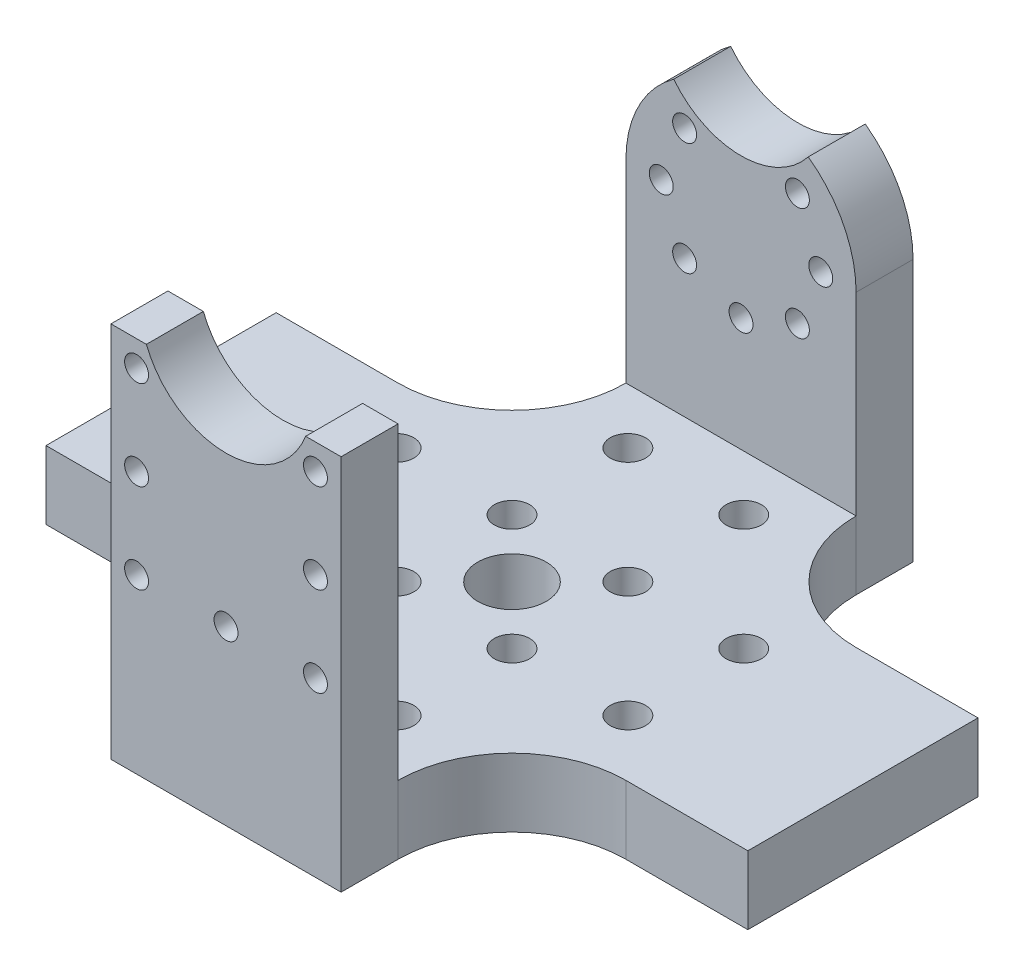
from build123d import *

# Parameters (mm, degrees)
BOSS_EXTRUDE1_DEPTH = 50.2
CUT_EXTRUDE2_DEPTH  = 44.2
SKETCH3_W           = 20.2
SKETCH3_H           = 10.1
BOSS_EXTRUDE2_DEPTH = 5
SKETCH4_R           = 1.05
CUT_EXTRUDE3_DEPTH  = 11
SKETCH5_R           = 4
SKETCH5_R_2         = 7.5
CUT_EXTRUDE4_DEPTH  = 11
SKETCH6_R           = 4
BOSS_EXTRUDE3_DEPTH = 5
SKETCH7_R           = 4
SKETCH7_R_2         = 1.05
CUT_EXTRUDE5_DEPTH  = 16
SKETCH8_R           = 7.5
CUT_EXTRUDE6_DEPTH  = 11
SKETCH9_R           = 4
BOSS_EXTRUDE4_DEPTH = 5
SKETCH11_W          = 20.2
SKETCH11_H          = 50.2
BOSS_EXTRUDE5_DEPTH = 3
SKETCH12_R          = 3
SKETCH12_R_2        = 1.55
CUT_EXTRUDE8_DEPTH  = 23
SKETCH13_W          = 20.7
SKETCH13_H          = 20.2
BOSS_EXTRUDE6_DEPTH = 6
SKETCH14_R          = 1.55
CUT_EXTRUDE9_DEPTH  = 6
SKETCH15_R          = 1.55
CUT_EXTRUDE10_DEPTH = 6
FILLET1_R           = 10
FILLET2_R           = 10
FILLET3_R           = 10


with BuildPart() as part:
    # Sketch1 → Boss-Extrude1 (new body)
    with BuildSketch(Plane.XY):
        with BuildLine():
            Line((-10.1, 0), (-10.1, -20))
            Line((-10.1, -20), (10.1, -20))
            Line((10.1, -20), (10.1, 0))
            ThreePointArc((10.1, 0), (0, 10.1), (-10.1, 0))
        make_face()
    extrude(amount=BOSS_EXTRUDE1_DEPTH)

    # Sketch2 → Cut-Extrude2 (cut)
    with BuildSketch(Plane.ZY.offset(10.1)):
        Polygon((5, -10), (5, -17), (45.2, -17), (45.2, -10), (45.2, 11.866817026), (5, 11.866817026), align=None)
    extrude(amount=-CUT_EXTRUDE2_DEPTH, mode=Mode.SUBTRACT)

    # Sketch3 → Boss-Extrude2 (add)
    with BuildSketch(Plane.XY.offset(50.2)):
        with Locations((0, 5.05)):
            Rectangle(SKETCH3_W, SKETCH3_H)
    extrude(amount=-BOSS_EXTRUDE2_DEPTH)

    # Sketch4 → Cut-Extrude3 (cut, symmetric)
    with BuildSketch(Plane.XY.offset(50.2)):
        with Locations((-7.85, 7.85)):
            Circle(SKETCH4_R)
        with Locations((7.85, 7.85)):
            Circle(SKETCH4_R)
        with Locations((-7.85, -7.85)):
            Circle(SKETCH4_R)
        with Locations((7.85, -7.85)):
            Circle(SKETCH4_R)
        with Locations((0, 7.85)):
            Circle(SKETCH4_R)
        with Locations((0, -7.85)):
            Circle(SKETCH4_R)
        with Locations((-7.85, 0)):
            Circle(SKETCH4_R)
        with Locations((7.85, 0)):
            Circle(SKETCH4_R)
    extrude(amount=CUT_EXTRUDE3_DEPTH, both=True, mode=Mode.SUBTRACT)

    # Sketch5 → Cut-Extrude4 (cut, symmetric)
    with BuildSketch(Plane.XY.offset(50.2)):
        Circle(SKETCH5_R)
        with Locations((0, 12.82)):
            Circle(SKETCH5_R_2)
    extrude(amount=CUT_EXTRUDE4_DEPTH, both=True, mode=Mode.SUBTRACT)

    # Sketch6 → Boss-Extrude3 (add)
    with BuildSketch(Plane.XY.offset(50.2)):
        Circle(SKETCH6_R)
    extrude(amount=-BOSS_EXTRUDE3_DEPTH)

    # Sketch7 → Cut-Extrude5 (cut, symmetric)
    with BuildSketch(Plane(origin=(0, 0, 0), x_dir=(-1, 0, 0), z_dir=(0, 0, -1))):
        with Locations(Location((0, 0, 0), (0, 0, 90))):
            Circle(SKETCH7_R)
        with Locations(Location((0, 7, 0), (0, 0, 90))):
            Circle(SKETCH7_R_2)
        with Locations(Location((-4.949747468, 4.949747468, 0), (0, 0, 90))):
            Circle(SKETCH7_R_2)
        with Locations(Location((-7, 0, 0), (0, 0, 90))):
            Circle(SKETCH7_R_2)
        with Locations(Location((-4.949747468, -4.949747468, 0), (0, 0, 90))):
            Circle(SKETCH7_R_2)
        with Locations(Location((0, -7, 0), (0, 0, 90))):
            Circle(SKETCH7_R_2)
        with Locations(Location((4.949747468, -4.949747468, 0), (0, 0, 90))):
            Circle(SKETCH7_R_2)
        with Locations(Location((7, 0, 0), (0, 0, 90))):
            Circle(SKETCH7_R_2)
        with Locations(Location((4.949747468, 4.949747468, 0), (0, 0, 90))):
            Circle(SKETCH7_R_2)
    extrude(amount=CUT_EXTRUDE5_DEPTH, both=True, mode=Mode.SUBTRACT)

    # Sketch8 → Cut-Extrude6 (cut, symmetric)
    with BuildSketch(Plane(origin=(0, 0, 0), x_dir=(-1, 0, 0), z_dir=(0, 0, -1))):
        with Locations((0, 12.82)):
            Circle(SKETCH8_R)
    extrude(amount=CUT_EXTRUDE6_DEPTH, both=True, mode=Mode.SUBTRACT)

    # Sketch9 → Boss-Extrude4 (add)
    with BuildSketch(Plane(origin=(0, 0, 0), x_dir=(-1, 0, 0), z_dir=(0, 0, -1))):
        Circle(SKETCH9_R)
    extrude(amount=-BOSS_EXTRUDE4_DEPTH)

    # Sketch11 → Boss-Extrude5 (add)
    with BuildSketch(Plane(origin=(0, -20, 0), x_dir=(-1, 0, 0), z_dir=(0, -1, 0))):
        with Locations((0, -25.1)):
            Rectangle(SKETCH11_W, SKETCH11_H)
    extrude(amount=BOSS_EXTRUDE5_DEPTH)

    # Sketch12 → Cut-Extrude8 (cut)
    with BuildSketch(Plane(origin=(0, -17, 0), x_dir=(1, 0, 0), z_dir=(0, 1, 0))):
        with Locations(Location((0, -25.1, 0), (0, 0, 270))):
            Circle(SKETCH12_R)
        with Locations(Location((-5.084097757, -20.015902243, 0), (0, 0, 270))):
            Circle(SKETCH12_R_2)
        with Locations(Location((5.084097757, -20.015902243, 0), (0, 0, 270))):
            Circle(SKETCH12_R_2)
        with Locations(Location((5.084097757, -30.184097757, 0), (0, 0, 270))):
            Circle(SKETCH12_R_2)
        with Locations(Location((-5.084097757, -30.184097757, 0), (0, 0, 270))):
            Circle(SKETCH12_R_2)
    extrude(amount=-CUT_EXTRUDE8_DEPTH, mode=Mode.SUBTRACT)

    # Sketch13 → Boss-Extrude6 (add)
    with BuildSketch(Plane(origin=(0, -23, 0), x_dir=(-1, 0, 0), z_dir=(0, -1, 0))):
        with Locations((20.45, -25.1)):
            Rectangle(SKETCH13_W, SKETCH13_H)
        with Locations((-20.45, -25.1)):
            Rectangle(SKETCH13_W, SKETCH13_H)
    extrude(amount=-BOSS_EXTRUDE6_DEPTH)

    # Sketch14 → Cut-Extrude9 (cut)
    with BuildSketch(Plane.XZ.offset(23)):
        with Locations(Location((-15.254097757, 20.015902243, 0), (0, 0, 270))):
            Circle(SKETCH14_R)
        with Locations(Location((-15.254097757, 30.184097757, 0), (0, 0, 90))):
            Circle(SKETCH14_R)
        with Locations(Location((15.254097757, 30.184097757, 0), (0, 0, 270))):
            Circle(SKETCH14_R)
        with Locations(Location((15.254097757, 20.015902243, 0), (0, 0, 90))):
            Circle(SKETCH14_R)
    extrude(amount=-CUT_EXTRUDE9_DEPTH, mode=Mode.SUBTRACT)

    # Sketch15 → Cut-Extrude10 (cut)
    with BuildSketch(Plane(origin=(0, -23, 0), x_dir=(-1, 0, 0), z_dir=(0, -1, 0))):
        with Locations(Location((-5.084097757, -9.845902243, 0), (0, 0, 90))):
            Circle(SKETCH15_R)
        with Locations(Location((5.084097757, -9.845902243, 0), (0, 0, 270))):
            Circle(SKETCH15_R)
        with Locations(Location((-5.084097757, -40.354097757, 0), (0, 0, 270))):
            Circle(SKETCH15_R)
        with Locations(Location((5.084097757, -40.354097757, 0), (0, 0, 90))):
            Circle(SKETCH15_R)
    extrude(amount=-CUT_EXTRUDE10_DEPTH, mode=Mode.SUBTRACT)

    # Fillet1
    fillet1_edges = [part.edges().sort_by_distance(p)[0] for p in [
        (-10.1, -20, 35.2),
    ]]
    fillet(fillet1_edges, radius=FILLET1_R)

    # Fillet2
    fillet2_edges = [part.edges().sort_by_distance(p)[0] for p in [
        (-10.1, -20, 15),
    ]]
    fillet(fillet2_edges, radius=FILLET2_R)

    # Fillet3
    fillet3_edges = [part.edges().sort_by_distance(p)[0] for p in [
        (10.1, -20, 35.2),
        (10.1, -20, 15),
    ]]
    fillet(fillet3_edges, radius=FILLET3_R)


solid = part.part
